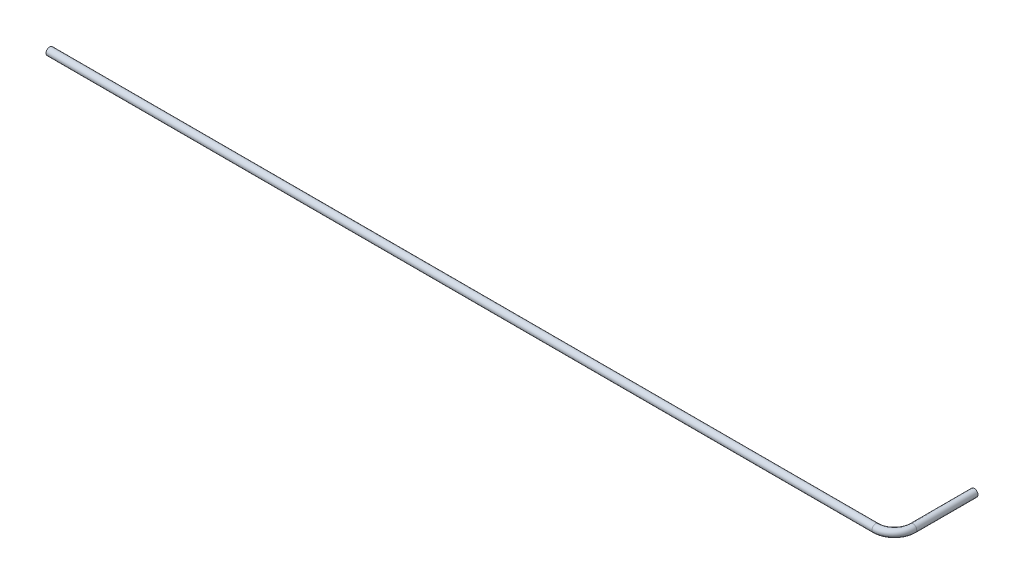
from build123d import *

# Parameters (mm, degrees)
SKETCH3_R = 0.5


with BuildPart() as part:
    # Sweep1: sweep along a path in Sketch1
    with BuildLine(Plane(origin=(0, 0, 0), x_dir=(1, 0, 0), z_dir=(0, 1, 0))) as sweep1_path:
        Line((0, 10.857648334), (0, 2.54))
        ThreePointArc((0, 2.54), (-0.743948776, 0.743948776), (-2.54, 0))
        Line((-2.54, 0), (-114.742555238, 0))
    # Sketch3 → Sweep1 (sweep)
    with BuildSketch(Plane.XY.offset(-10.857648334)):
        Circle(SKETCH3_R)
    sweep(path=sweep1_path.line)


solid = part.part
